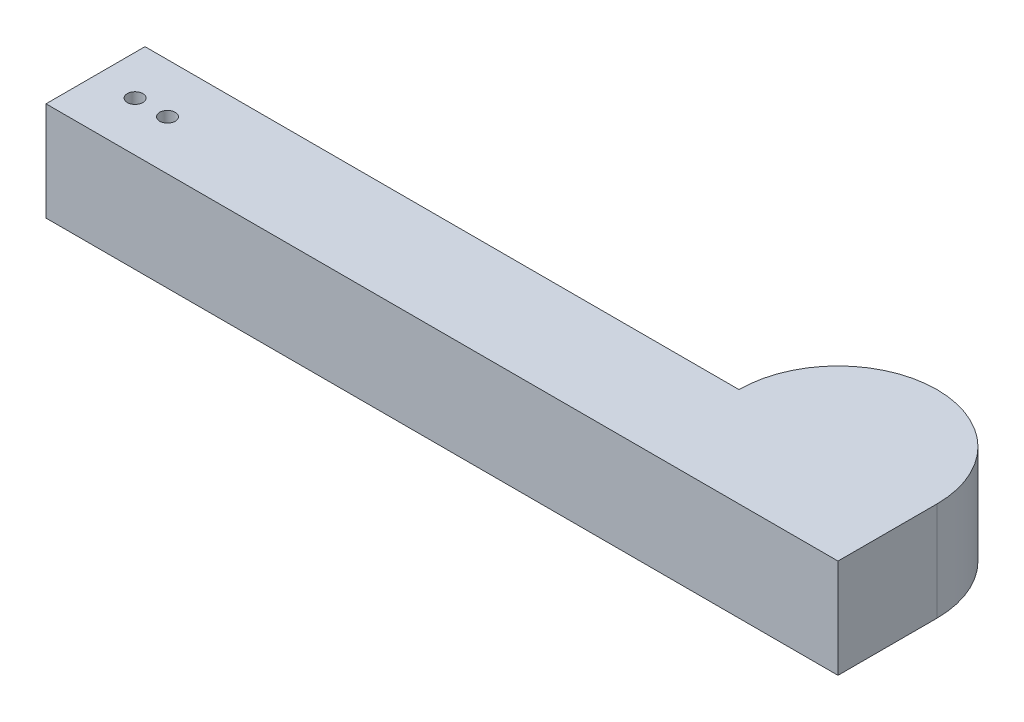
from build123d import *

# Parameters (mm, degrees)
BOSS_EXTRUDE1_DEPTH = 25.4
SKETCH2_R           = 1.99898
CUT_EXTRUDE1_DEPTH  = 25.4


with BuildPart() as part:
    # Sketch1 → Boss-Extrude1 (new body)
    with BuildSketch(Plane(origin=(0, 0, 0), x_dir=(1, 0, 0), z_dir=(0, 1, 0))):
        with BuildLine():
            Line((0, 0), (203.2, 0))
            Line((203.2, 0), (203.2, 25.4))
            ThreePointArc((203.2, 25.4), (177.8, 50.8), (152.4, 25.4))
            Line((152.4, 25.4), (0, 25.4))
            Line((0, 25.4), (0, 0))
        make_face()
    extrude(amount=BOSS_EXTRUDE1_DEPTH)

    # Sketch2 → Cut-Extrude1 (cut)
    with BuildSketch(Plane(origin=(0, 25.4, 0), x_dir=(1, 0, 0), z_dir=(0, 1, 0))):
        with Locations(Location((10.16, 12.7, 0), (0, 0, 270))):
            Circle(SKETCH2_R)
        with Locations(Location((18.4658, 12.7, 0), (0, 0, 270))):
            Circle(SKETCH2_R)
    extrude(amount=-CUT_EXTRUDE1_DEPTH, mode=Mode.SUBTRACT)


solid = part.part
